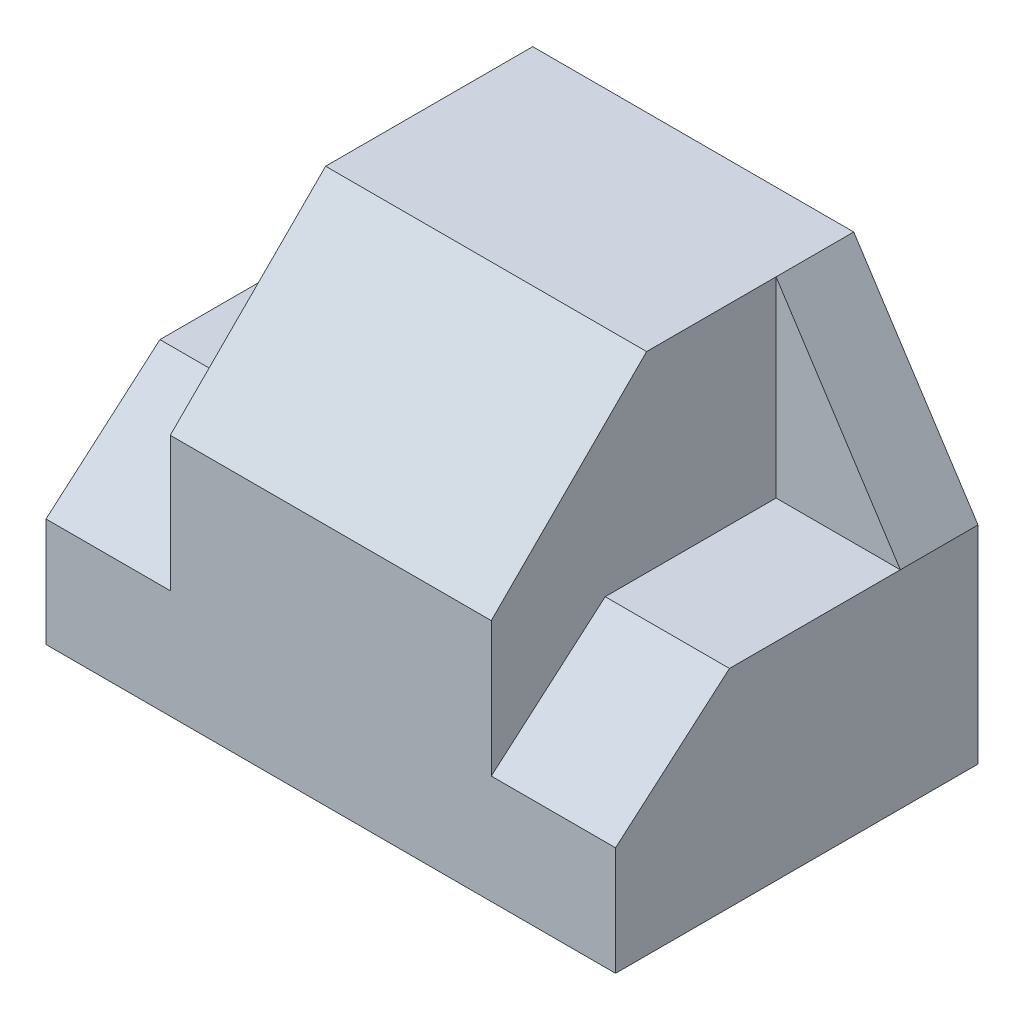
from build123d import *

# Parameters (mm, degrees)
EXTRUDE_4_DEPTH  = 70
SKETCH_4_3_W     = 24
SKETCH_4_3_H     = 19
EXTRUDE_5_DEPTH  = 48
SKETCH_4_4_W     = 31
SKETCH_4_4_H     = 30
EXTRUDE_6_DEPTH  = 40
EXTRUDE_7_DEPTH  = 15
EXTRUDE_8_DEPTH  = 62
EXTRUDE_9_DEPTH  = 24
EXTRUDE_10_DEPTH = 86


with BuildPart() as part:
    # 스케치4 → 보스-돌출4 (new body)
    with BuildSketch(Plane.XY):
        Polygon((-55, 0), (0, 0), (0, 47), (-31, 47), (-31, 40), (-31, 21), (-55, 21), align=None)
        Polygon((0, 47), (0, 0), (55, 0), (55, 21), (31, 21), (31, 40), (31, 47), align=None)
    extrude(amount=EXTRUDE_4_DEPTH)

    # 스케치4<3> → 보스-돌출5 (add)
    with BuildSketch(Plane.XY):
        with Locations((43, 30.5)):
            Rectangle(SKETCH_4_3_W, SKETCH_4_3_H)
        with Locations((-43, 30.5)):
            Rectangle(SKETCH_4_3_W, SKETCH_4_3_H)
    extrude(amount=EXTRUDE_5_DEPTH)

    # 스케치4<4> → 보스-돌출6 (add)
    with BuildSketch(Plane.XY):
        with Locations((-15.5, 62)):
            Rectangle(SKETCH_4_4_W, SKETCH_4_4_H)
        with Locations((15.5, 62)):
            Rectangle(SKETCH_4_4_W, SKETCH_4_4_H)
    extrude(amount=EXTRUDE_6_DEPTH)

    # 스케치4<5> → 보스-돌출7 (add)
    with BuildSketch(Plane.XY):
        Polygon((31, 40), (55, 40), (31, 77), (31, 47), align=None)
        Polygon((-31, 77), (-55, 40), (-31, 40), (-31, 47), align=None)
    extrude(amount=EXTRUDE_7_DEPTH)

    # 스케치6 → 보스-돌출8 (add)
    with BuildSketch(Plane(origin=(31, 0, 0), x_dir=(0, 0, -1), z_dir=(1, 0, 0))):
        Polygon((-40, 77), (-70, 47), (-40, 47), align=None)
    extrude(amount=-EXTRUDE_8_DEPTH)

    # 스케치6<3> → 보스-돌출9 (add)
    with BuildSketch(Plane(origin=(31, 0, 0), x_dir=(0, 0, -1), z_dir=(1, 0, 0))):
        Polygon((-48, 40), (-70, 21), (-48, 21), align=None)
    extrude(amount=EXTRUDE_9_DEPTH)

    # 스케치6<4> → 보스-돌출10 (add)
    with BuildSketch(Plane(origin=(31, 0, 0), x_dir=(0, 0, -1), z_dir=(1, 0, 0))):
        Polygon((-48, 40), (-70, 21), (-48, 21), align=None)
    extrude(amount=-EXTRUDE_10_DEPTH)


solid = part.part
